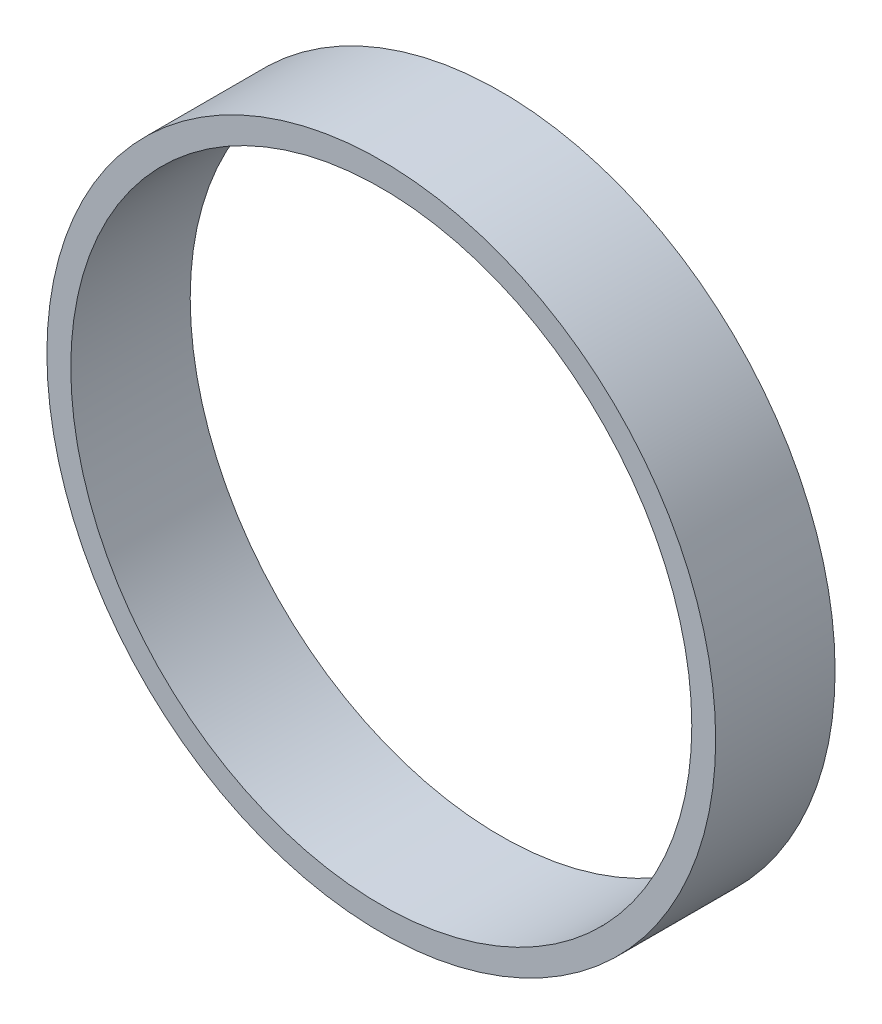
from build123d import *

# Parameters (mm, degrees)
ESQUISSE1_R        = 28
ESQUISSE1_R_2      = 26
BOSS_EXTRU_1_DEPTH = 10


with BuildPart() as part:
    # Esquisse1 → Boss.-Extru.1 (new body)
    with BuildSketch(Plane.XY):
        Circle(ESQUISSE1_R)
        Circle(ESQUISSE1_R_2, mode=Mode.SUBTRACT)
    extrude(amount=BOSS_EXTRU_1_DEPTH)


solid = part.part
